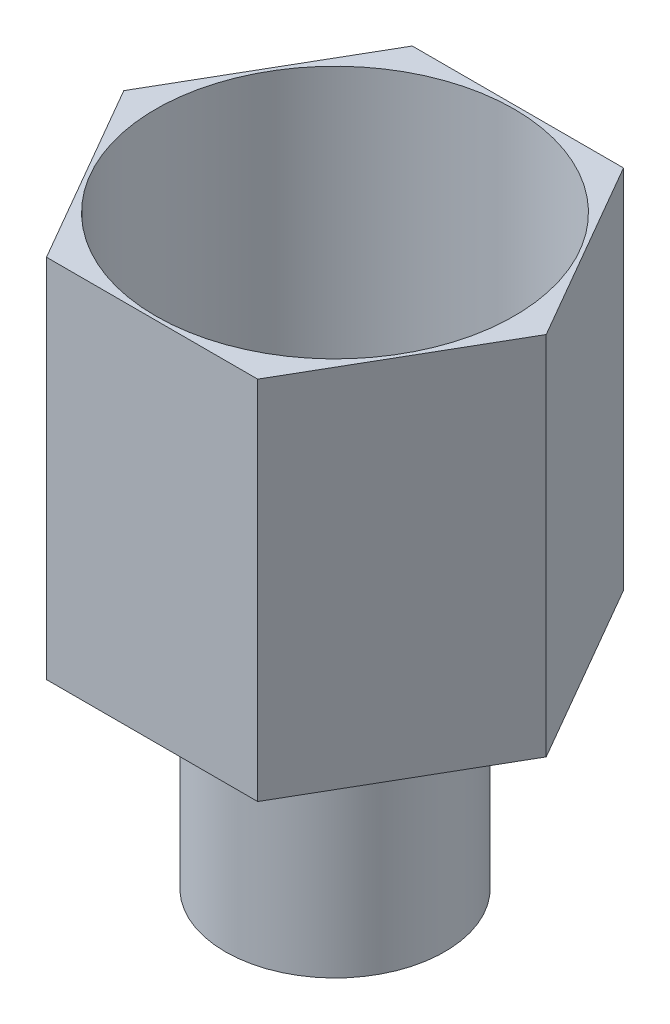
from build123d import *

# Parameters (mm, degrees)
BOSS_EXTRUDE1_DEPTH = 5
CUT_EXTRUDE1_START  = 5
SKETCH2_R           = 2.45
CUT_EXTRUDE1_DEPTH  = 4
SKETCH3_R           = 1.5
BOSS_EXTRUDE2_DEPTH = 3


with BuildPart() as part:
    # Sketch1 → Boss-Extrude1 (new body)
    with BuildSketch(Plane(origin=(0, 0, 0), x_dir=(1, 0, 0), z_dir=(0, 1, 0))):
        Polygon((1.443375673, -2.5), (2.886751346, 0), (1.443375673, 2.5), (-1.443375673, 2.5), (-2.886751346, 0), (-1.443375673, -2.5), align=None)
    extrude(amount=BOSS_EXTRUDE1_DEPTH)

    # Sketch2 → Cut-Extrude1 (cut)
    with BuildSketch(Plane(origin=(0, 0, 0), x_dir=(1, 0, 0), z_dir=(0, 1, 0)).offset(CUT_EXTRUDE1_START)):
        with Locations(Location((0, 0, 0), (0, 0, 270))):
            Circle(SKETCH2_R)
    extrude(amount=-CUT_EXTRUDE1_DEPTH, mode=Mode.SUBTRACT)

    # Sketch3 → Boss-Extrude2 (add)
    with BuildSketch(Plane(origin=(0, 0, 0), x_dir=(1, 0, 0), z_dir=(0, 1, 0))):
        with Locations(Location((0, 0, 0), (0, 0, 270))):
            Circle(SKETCH3_R)
    extrude(amount=-BOSS_EXTRUDE2_DEPTH)


solid = part.part
